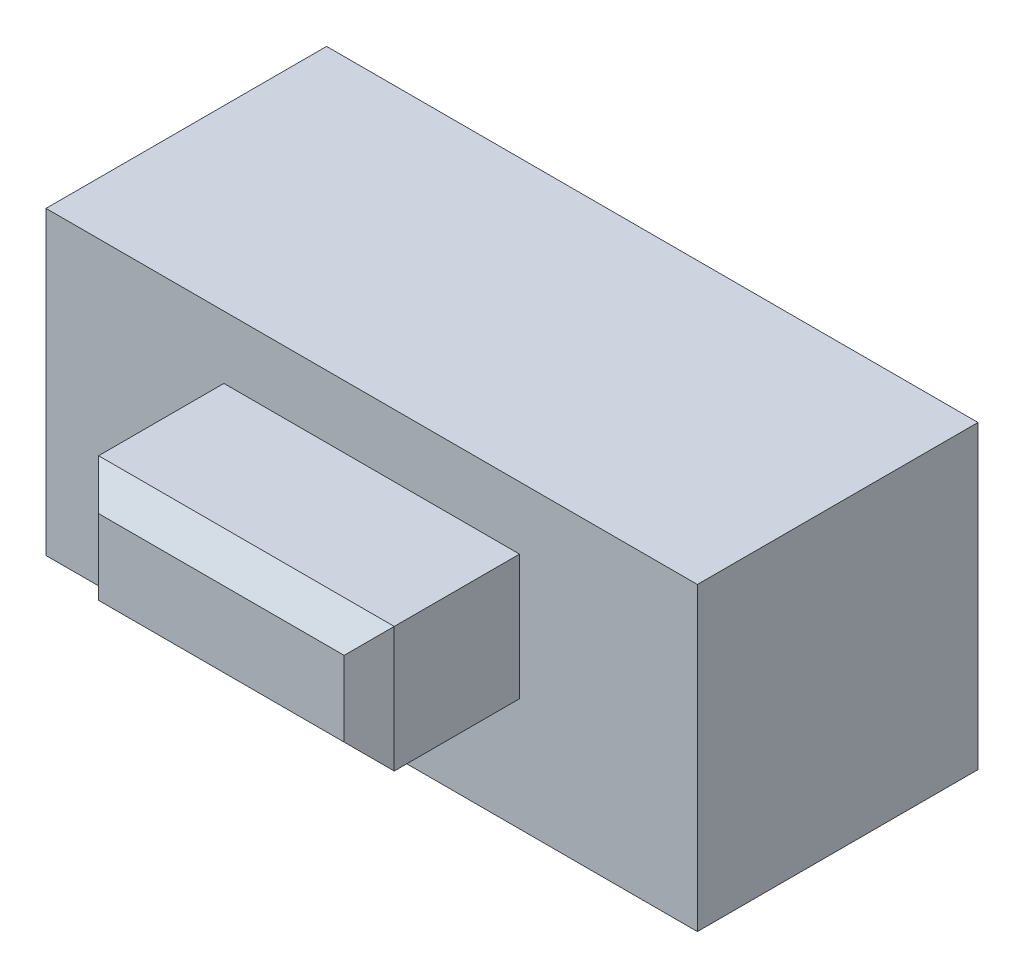
from build123d import *

# Parameters (mm, degrees)
SKETCH1_W           = 13
SKETCH1_H           = 5.6
BOSS_EXTRUDE1_DEPTH = 6
SKETCH2_W           = 5.9
SKETCH2_H           = 2.5
BOSS_EXTRUDE2_DEPTH = 3
CHAMFER1_SIZE       = 0.5


with BuildPart() as part:
    # Sketch1 → Boss-Extrude1 (new body)
    with BuildSketch(Plane(origin=(0, 0, 0), x_dir=(1, 0, 0), z_dir=(0, 1, 0))):
        Rectangle(SKETCH1_W, SKETCH1_H)
    extrude(amount=BOSS_EXTRUDE1_DEPTH)

    # Sketch2 → Boss-Extrude2 (add)
    with BuildSketch(Plane.XY.offset(2.8)):
        with Locations((0, 3.5)):
            Rectangle(SKETCH2_W, SKETCH2_H)
    extrude(amount=BOSS_EXTRUDE2_DEPTH)

    # Chamfer1
    chamfer1_edges = [part.edges().sort_by_distance(p)[0] for p in [
        (2.95, 3.5, 5.8),
        (0, 4.75, 5.8),
        (-2.95, 3.5, 5.8),
        (0, 2.25, 5.8),
    ]]
    chamfer(chamfer1_edges, length=CHAMFER1_SIZE)


solid = part.part
